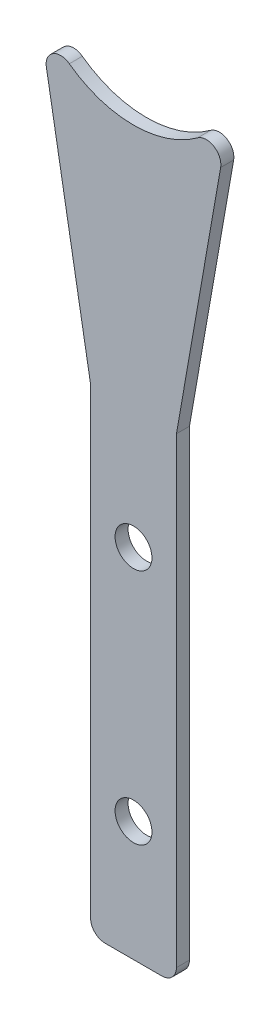
from build123d import *

# Parameters (mm, degrees)
SKETCH1_R            = 2
BOSS_EXTRUDE1_DEPTH  = 1.5875
FILLET2_R            = 1.778
M4_CLEARANCE_HOLE2_D = 4.5


with BuildPart() as part:
    # Sketch1 → Boss-Extrude1 (new body)
    with BuildSketch(Plane.XY):
        with BuildLine():
            Line((-3.078924099, -28.617866551), (2.159951047, -28.617866551))
            Line((2.159951047, -28.617866551), (7.398508015, -28.617866551))
            Line((7.398508015, -28.617866551), (7.398508015, 29.568125765))
            Line((7.398508015, 29.568125765), (13.896694252, 66.719401178))
            ThreePointArc((13.896694252, 66.719401178), (2.158041982, 59.568125704), (-9.580610288, 66.719401178))
            Line((-9.580610288, 66.719401178), (-3.078924099, 29.568125765))
            Line((-3.078924099, 29.568125765), (-3.078924099, -28.617866551))
        make_face()
        with BuildLine():
            ThreePointArc((4.159951047, -14.006866551), (3.574164609, -15.421080114), (2.159951047, -16.006866551))
            ThreePointArc((2.159951047, -16.006866551), (0.745737485, -12.592652989), (4.159951047, -14.006866551))
        make_face(mode=Mode.SUBTRACT)
        with Locations((2.159951047, 14.957125769)):
            Circle(SKETCH1_R, mode=Mode.SUBTRACT)
    extrude(amount=BOSS_EXTRUDE1_DEPTH)

    # Fillet2
    fillet2_edges = [part.edges().sort_by_distance(p)[0] for p in [
        (-9.580610288, 66.719401178, 0.79375),
        (13.896694252, 66.719401178, 0.79375),
        (7.398508015, -28.617866551, 0.79375),
        (-3.078924099, -28.617866551, 0.79375),
    ]]
    fillet(fillet2_edges, radius=FILLET2_R)

    # M4 Clearance Hole2 (through all)
    with Locations(Plane.XY.offset(1.5875)):
        with Locations((2.159951047, 14.957125769), (2.159951047, -14.006866551)):
            Hole(M4_CLEARANCE_HOLE2_D / 2)


solid = part.part
